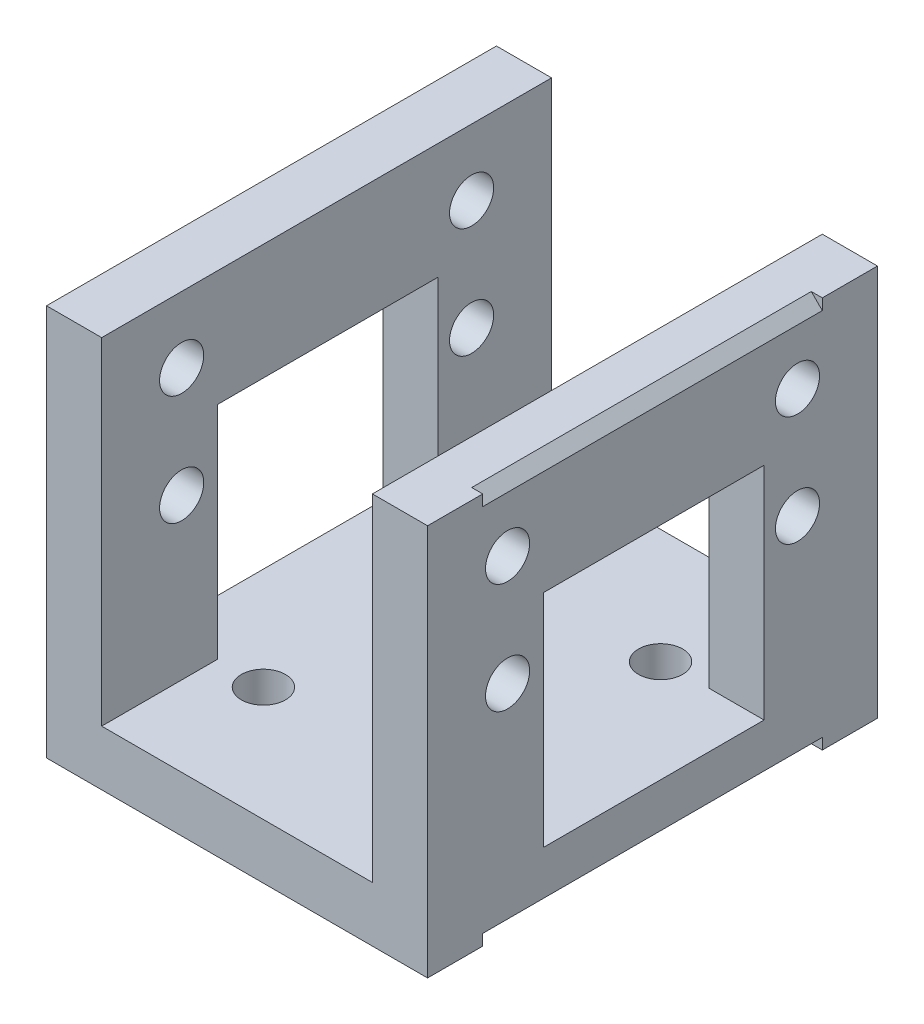
from build123d import *

# Parameters (mm, degrees)
EXTRUDE_2_DEPTH     = 34.78
CUT_EXTRUDE_1_REACH = 62.522
SKETCH_2_W          = 20
SKETCH_2_H          = 20
CHAMFER_1_SIZE      = 1
CUT_EXTRUDE_START   = -34.54
SKETCH_3_R          = 2
CUT_EXTRUDE_2_DEPTH = 34.54
SKETCH_4_R          = 2
CUT_EXTRUDE_3_DEPTH = 5
EXTRUDE_START       = -2
EXTRUDE_3_DEPTH     = 5


with BuildPart() as part:
    # 草图1 → 凸台-拉伸2 (new body)
    with BuildSketch(Plane.XY):
        Polygon((0, 0), (0, 35.5), (5, 35.5), (5, 5), (29.54, 5), (29.54, 35.5), (34.54, 35.5), (34.54, 0), align=None)
    extrude(amount=EXTRUDE_2_DEPTH)

    # 切除-拉伸1: up to this face of the body (flat: up to its plane)
    cut_extrude_1_end = Plane(part.part.faces().sort_by_distance((0, 17.75, 17.39))[0])
    # 草图2 → 切除-拉伸1 (cut, up to the picked face)
    with BuildSketch(Plane(origin=(34.54, 0, 0), x_dir=(0, 0, -1), z_dir=(1, 0, 0)), mode=Mode.PRIVATE) as cut_extrude_1_sk1:
        with Locations((-17.28, 15)):
            Rectangle(SKETCH_2_W, SKETCH_2_H)
    cut_extrude_1_tool1 = split(extrude(cut_extrude_1_sk1.sketch, amount=-CUT_EXTRUDE_1_REACH, mode=Mode.PRIVATE), bisect_by=cut_extrude_1_end, keep=Keep.BOTH, mode=Mode.PRIVATE)
    add(cut_extrude_1_tool1.solids().sort_by(Axis((34.54, 15, 17.28), (-1, 0, 0)))[0], mode=Mode.SUBTRACT)

    # 倒角1
    chamfer_1_edges = [part.edges().sort_by_distance(p)[0] for p in [
        (34.54, 17.75, 0),
        (17.27, 0, 0),
        (0, 0, 17.39),
        (34.54, 35.5, 17.39),
        (34.54, 0, 17.39),
        (0, 17.75, 34.78),
        (17.27, 0, 34.78),
        (0, 17.75, 0),
        (34.54, 17.75, 34.78),
    ]]
    chamfer(chamfer_1_edges, length=CHAMFER_1_SIZE)

    # 草图3 → 切除-拉伸2 (cut)
    with BuildSketch(Plane(origin=(34.54, 0, 0), x_dir=(0, 0, -1), z_dir=(1, 0, 0)).offset(CUT_EXTRUDE_START)):
        with Locations((-30.53, 19.5)):
            Circle(SKETCH_3_R)
        with Locations((-4.25, 19.5)):
            Circle(SKETCH_3_R)
        with Locations((-4.25, 29.5)):
            Circle(SKETCH_3_R)
        with BuildLine():
            ThreePointArc((-31.619976701, 31.176887233), (-32.53, 29.5), (-31.619976701, 27.823112767))
            Line((-31.619976701, 27.823112767), (-30.53, 29.5))
            Line((-30.53, 29.5), (-31.619976701, 31.176887233))
        make_face()
        with BuildLine():
            Line((-30.53, 29.5), (-31.619976701, 27.823112767))
            ThreePointArc((-31.619976701, 27.823112767), (-30.53, 27.5), (-29.440023299, 27.823112767))
            Line((-29.440023299, 27.823112767), (-30.53, 29.5))
        make_face()
        with BuildLine():
            Line((-30.53, 29.5), (-29.440023299, 27.823112767))
            ThreePointArc((-29.440023299, 27.823112767), (-28.772167044, 28.546048587), (-28.53, 29.5))
            ThreePointArc((-28.53, 29.5), (-28.772167044, 30.453951413), (-29.440023299, 31.176887233))
            Line((-29.440023299, 31.176887233), (-30.53, 29.5))
        make_face()
        with BuildLine():
            ThreePointArc((-29.440023299, 31.176887233), (-30.53, 31.5), (-31.619976701, 31.176887233))
            Line((-31.619976701, 31.176887233), (-30.53, 29.5))
            Line((-30.53, 29.5), (-29.440023299, 31.176887233))
        make_face()
    extrude(amount=CUT_EXTRUDE_2_DEPTH, mode=Mode.SUBTRACT)

    # 草图4 → 切除-拉伸3 (cut)
    with BuildSketch(Plane.XZ):
        with Locations(Location((9.27, 27.39, 0), (0, 0, 270))):
            Circle(SKETCH_4_R)
        with Locations(Location((25.27, 27.39, 0), (0, 0, 270))):
            Circle(SKETCH_4_R)
        with Locations(Location((25.27, 7.39, 0), (0, 0, 270))):
            Circle(SKETCH_4_R)
        with Locations(Location((9.27, 7.39, 0), (0, 0, 270))):
            Circle(SKETCH_4_R)
    extrude(amount=-CUT_EXTRUDE_3_DEPTH, mode=Mode.SUBTRACT)

    # 草图8 → 凸台-拉伸3 (add)
    with BuildSketch(Plane.XY.offset(34.78).offset(EXTRUDE_START)):
        Polygon((1, 35.5), (1, 1), (33.54, 1), (33.54, 35.5), (29.54, 35.5), (29.54, 5), (5, 5), (5, 35.5), align=None)
        Polygon((34.54, 1), (34.54, 34.5), (34.54, 35.5), (33.54, 35.5), (33.54, 1), (1, 1), (1, 35.5), (0, 35.5), (0, 1), (0, 0), (1, 0), (33.54, 0), (34.54, 0), align=None)
    extrude_3 = extrude(amount=EXTRUDE_3_DEPTH)

    # 镜向1: 凸台-拉伸3 across plane
    add(extrude_3.mirror(Plane.XY.offset(17.39)))


solid = part.part
